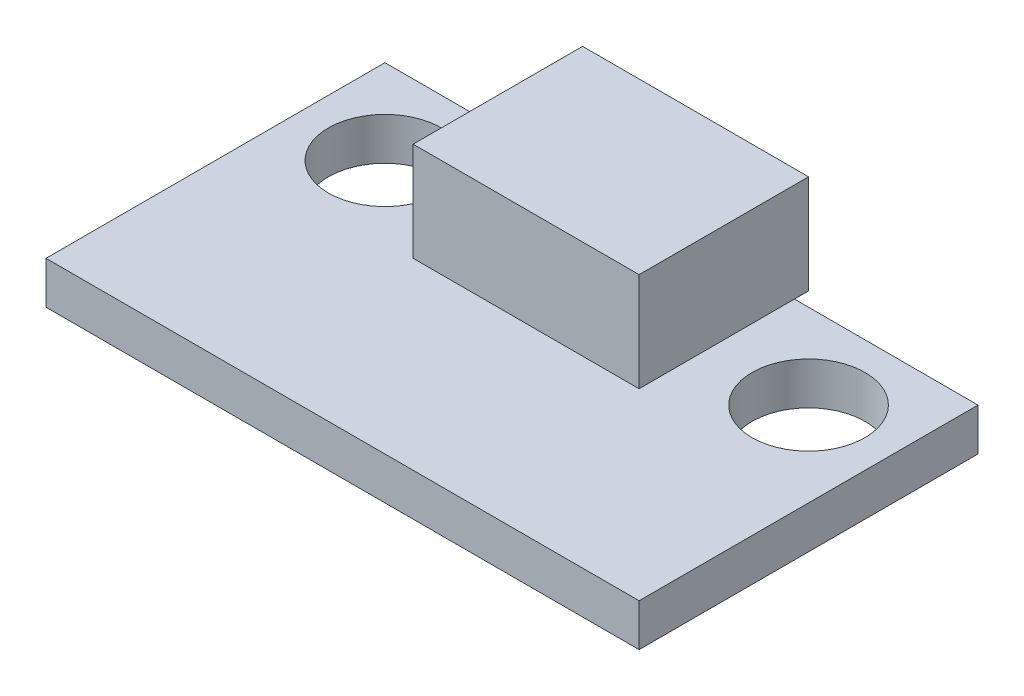
from build123d import *

# Parameters (mm, degrees)
SKETCH1_W           = 21
SKETCH1_H           = 12
BOSS_EXTRUDE1_DEPTH = 1.5
SKETCH2_R           = 2
CUT_EXTRUDE1_DEPTH  = 1.5
SKETCH3_W           = 8
SKETCH3_H           = 6
BOSS_EXTRUDE2_DEPTH = 3.5


with BuildPart() as part:
    # Sketch1 → Boss-Extrude1 (new body)
    with BuildSketch(Plane(origin=(0, 0, 0), x_dir=(1, 0, 0), z_dir=(0, 1, 0))):
        Rectangle(SKETCH1_W, SKETCH1_H)
    extrude(amount=BOSS_EXTRUDE1_DEPTH)

    # Sketch2 → Cut-Extrude1 (cut)
    with BuildSketch(Plane(origin=(0, 1.5, 0), x_dir=(1, 0, 0), z_dir=(0, 1, 0))):
        with Locations(Location((-7.5, 3, 0), (0, 0, 270))):
            Circle(SKETCH2_R)
        with Locations(Location((7.5, 3, 0), (0, 0, 270))):
            Circle(SKETCH2_R)
    extrude(amount=-CUT_EXTRUDE1_DEPTH, mode=Mode.SUBTRACT)

    # Sketch3 → Boss-Extrude2 (add)
    with BuildSketch(Plane(origin=(0, 1.5, 0), x_dir=(1, 0, 0), z_dir=(0, 1, 0))):
        with Locations((0, 3.5)):
            Rectangle(SKETCH3_W, SKETCH3_H)
    extrude(amount=BOSS_EXTRUDE2_DEPTH)


solid = part.part
